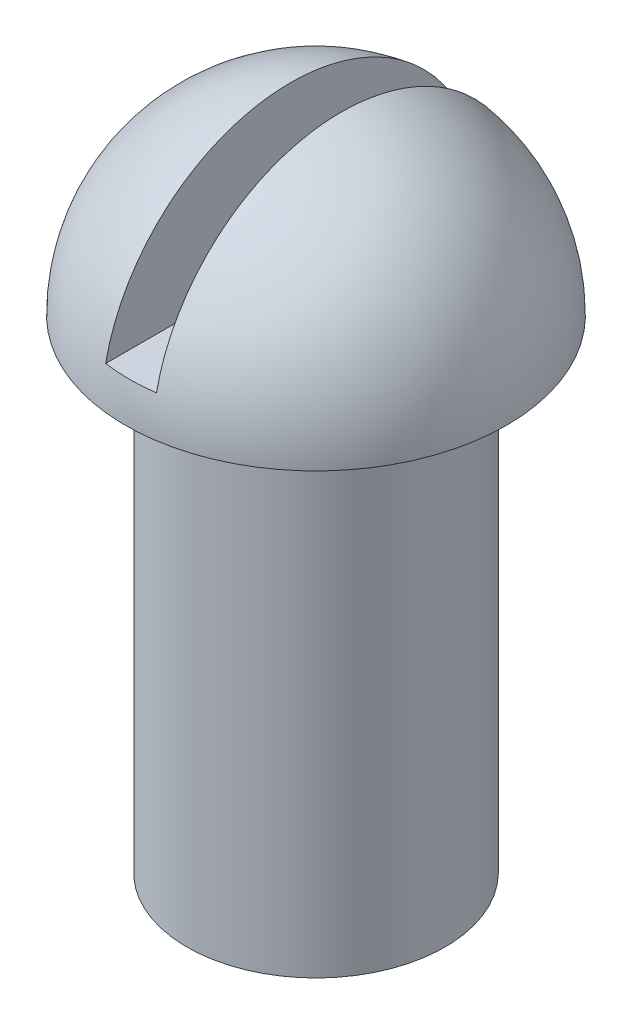
from build123d import *

# Parameters (mm, degrees)
CUT_EXTRUDE1_DEPTH      = 58.087651905
CUT_EXTRUDE1_DEPTH_BACK = 58.087651905
SKETCH2_W               = 4
SKETCH2_H               = 19.721325459


with BuildPart() as part:
    # Sketch1 → Revolve1 (revolve)
    with BuildSketch(Plane.XY):
        with BuildLine():
            Line((0, 53), (0, 0))
            Line((0, 0), (10.15, 0))
            Line((10.15, 0), (10.15, 38))
            Line((10.15, 38), (15, 38))
            ThreePointArc((15, 38), (10.606601718, 48.606601718), (0, 53))
        make_face()
    revolve(axis=Axis((0, 53, 0), (0, -1, 0)))

    # Sketch2 → Cut-Extrude1 (cut, two sides: drawn at the far end of the back side and taken through both)
    with BuildSketch(Plane.XY.offset(-CUT_EXTRUDE1_DEPTH_BACK)):
        with Locations((0, 50.86066273)):
            Rectangle(SKETCH2_W, SKETCH2_H)
    extrude(amount=CUT_EXTRUDE1_DEPTH + CUT_EXTRUDE1_DEPTH_BACK, mode=Mode.SUBTRACT)


solid = part.part
